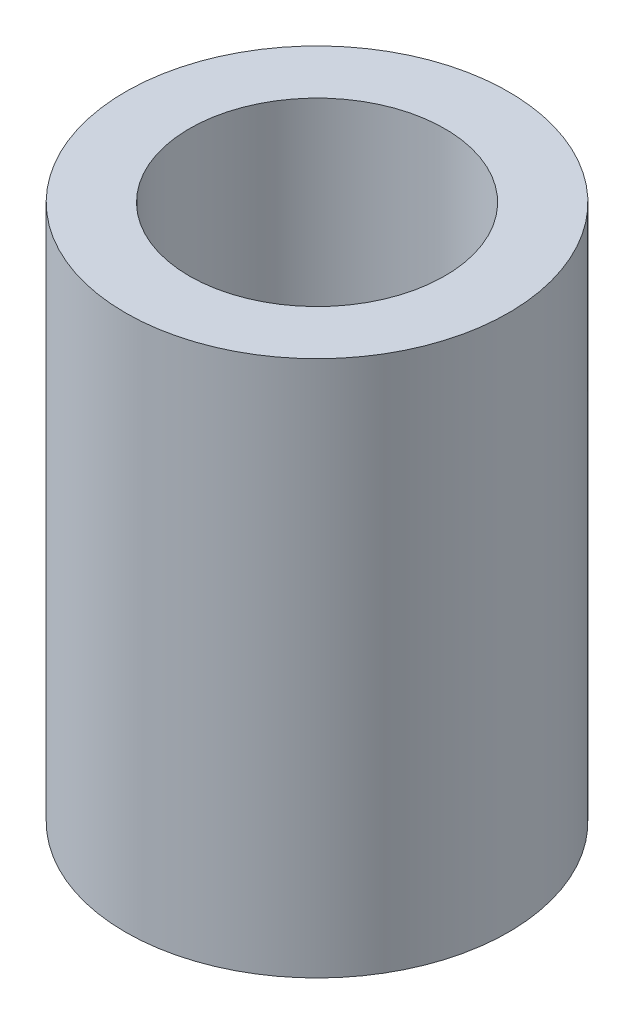
from build123d import *

# Parameters (mm, degrees)
SKETCH_1_R      = 1.5
SKETCH_1_R_2    = 1
EXTRUDE_1_DEPTH = 4.2


with BuildPart() as part:
    # Эскиз1 → Бобышка-Вытянуть1 (new body)
    with BuildSketch(Plane(origin=(0, 0, 0), x_dir=(1, 0, 0), z_dir=(0, 1, 0))):
        with Locations(Location((0, 0, 0), (0, 0, 270))):
            Circle(SKETCH_1_R)
        with Locations(Location((0, 0, 0), (0, 0, 270))):
            Circle(SKETCH_1_R_2, mode=Mode.SUBTRACT)
    extrude(amount=EXTRUDE_1_DEPTH)


solid = part.part
